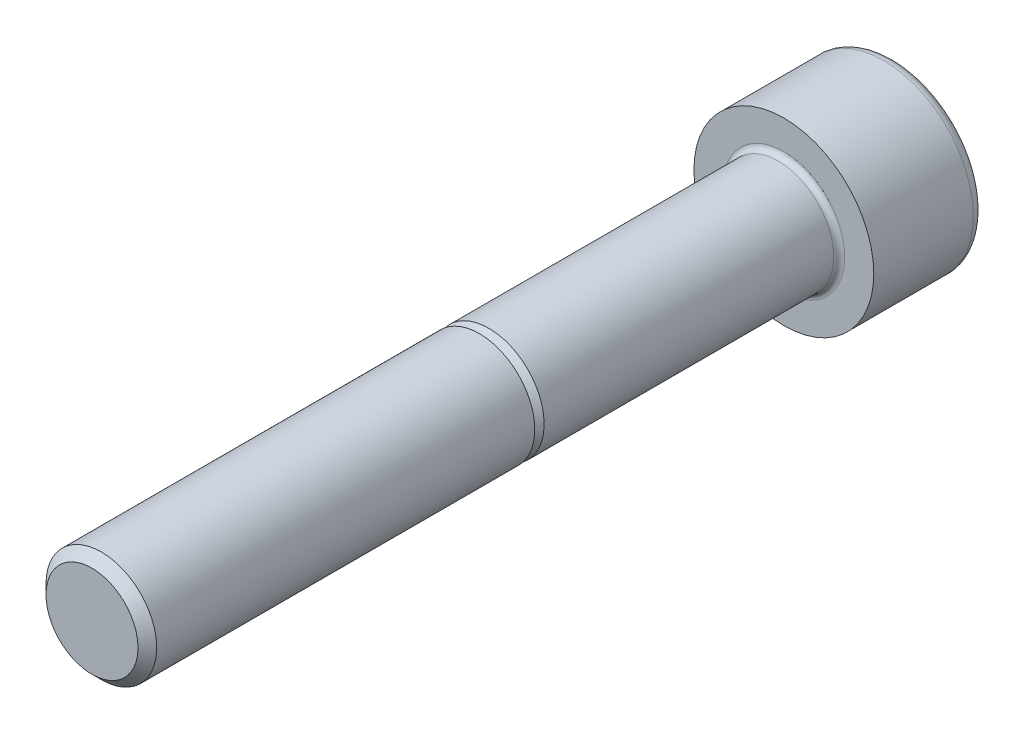
from build123d import *

# Parameters (mm, degrees)
SCHNITT_LINEAR_AUSTRAGEN1_DEPTH = 4
FASE1_SIZE                      = 0.6765625
VERRUNDUNG1_R                   = 0.4
VERRUNDUNG2_R                   = 0.8


with BuildPart() as part:
    # Skizze1 → Rotation1 (revolve)
    with BuildSketch(Plane.XZ, mode=Mode.PRIVATE) as rotation1_sk:
        Polygon((4, 50), (0, 50), (0, -8), (6.5, -8), (6.5, 0), (4, 0), (4, 21.3234375), (3.3234375, 22), (4, 22), align=None)
    revolve(rotation1_sk.sketch.rotate(Axis((0, 0, 50), (0, 0, -1)), 180), axis=Axis((0, 0, 50), (0, 0, -1)))

    # Skizze2 → Schnitt-Linear austragen1 (cut)
    with BuildSketch(Plane(origin=(0, 0, -8), x_dir=(-1, 0, 0), z_dir=(0, 0, -1))):
        Polygon((3, -1.732050808), (3, 1.732050808), (0, 3.464101615), (-3, 1.732050808), (-3, -1.732050808), (0, -3.464101615), align=None)
    extrude(amount=-SCHNITT_LINEAR_AUSTRAGEN1_DEPTH, mode=Mode.SUBTRACT)

    # Skizze3 → Schnitt-Rotation1 (revolve, cut)
    with BuildSketch(Plane(origin=(0, 0, 0), x_dir=(1, 0, 0), z_dir=(0, 1, 0)), mode=Mode.PRIVATE) as schnitt_rotation1_sk:
        Polygon((3, 4), (0, 4), (0, 2.267949192), align=None)
    revolve(schnitt_rotation1_sk.sketch.rotate(Axis((0, 0, -4), (0, 0, 1)), 180), axis=Axis((0, 0, -4), (0, 0, 1)), mode=Mode.SUBTRACT)

    # Fase1
    fase1_edges = [part.edges().sort_by_distance(p)[0] for p in [
        (4, 0, 50),
    ]]
    chamfer(fase1_edges, length=FASE1_SIZE)

    # Verrundung1
    verrundung1_edges = [part.edges().sort_by_distance(p)[0] for p in [
        (4, 0, 0),
    ]]
    fillet(verrundung1_edges, radius=VERRUNDUNG1_R)

    # Verrundung2
    verrundung2_edges = [part.edges().sort_by_distance(p)[0] for p in [
        (6.5, 0, -8),
    ]]
    fillet(verrundung2_edges, radius=VERRUNDUNG2_R)


solid = part.part
